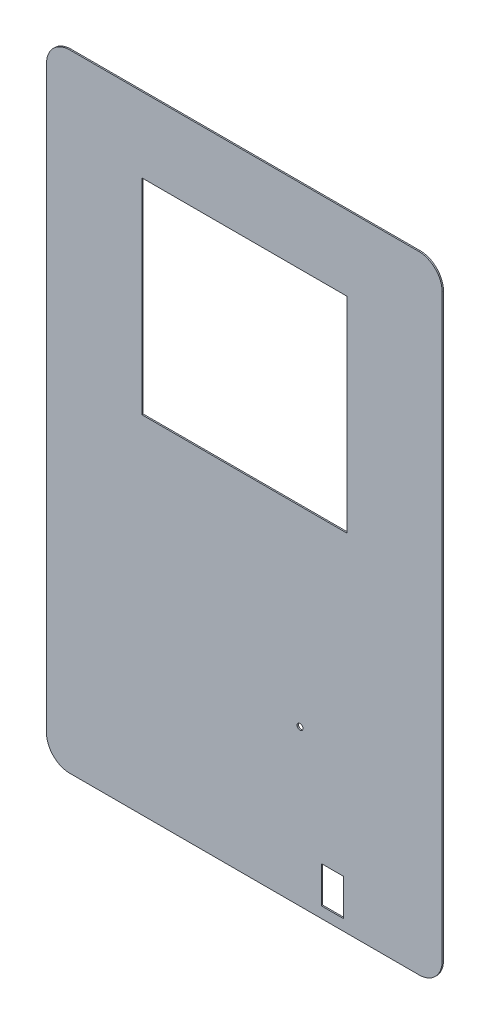
from build123d import *

# Parameters (mm, degrees)
EXTRUDE_1_DEPTH     = 0.18
CUT_EXTRUDE_1_REACH = 52.563
SKETCH_2_R          = 0.4
SKETCH_2_W          = 3
SKETCH_2_H          = 5
SKETCH_3_W          = 28
SKETCH_3_H          = 28
CUT_EXTRUDE_2_DEPTH = 0.18


with BuildPart() as part:
    # 草图1 → 凸台-拉伸1 (new body)
    with BuildSketch(Plane.XY):
        with BuildLine():
            Line((-23.82, -42.75), (23.82, -42.75))
            ThreePointArc((23.82, -42.75), (26.068599564, -41.818599564), (27, -39.57))
            Line((27, -39.57), (27, 39.57))
            ThreePointArc((27, 39.57), (26.068599564, 41.818599564), (23.82, 42.75))
            Line((23.82, 42.75), (-23.82, 42.75))
            ThreePointArc((-23.82, 42.75), (-26.068599564, 41.818599564), (-27, 39.57))
            Line((-27, 39.57), (-27, -39.57))
            ThreePointArc((-27, -39.57), (-26.068599564, -41.818599564), (-23.82, -42.75))
        make_face()
    extrude(amount=EXTRUDE_1_DEPTH)

    # 草图2 → 切除-拉伸1 (cut, up to next)
    with BuildSketch(Plane.XY.offset(0.18), mode=Mode.PRIVATE) as cut_extrude_1_sk1:
        with Locations((7.6, -21.55)):
            Circle(SKETCH_2_R)
    cut_extrude_1_tool1 = extrude(cut_extrude_1_sk1.sketch, amount=-CUT_EXTRUDE_1_REACH, mode=Mode.PRIVATE) & part.part
    # 草图2 → 切除-拉伸1 (cut, up to next)
    with BuildSketch(Plane.XY.offset(0.18), mode=Mode.PRIVATE) as cut_extrude_1_sk2:
        with Locations((12, -38.75)):
            Rectangle(SKETCH_2_W, SKETCH_2_H)
    cut_extrude_1_tool2 = extrude(cut_extrude_1_sk2.sketch, amount=-CUT_EXTRUDE_1_REACH, mode=Mode.PRIVATE) & part.part
    add(cut_extrude_1_tool1.solids().sort_by_distance((7.6, -21.55, 0.18))[0], mode=Mode.SUBTRACT)
    add(cut_extrude_1_tool2.solids().sort_by_distance((12, -38.75, 0.18))[0], mode=Mode.SUBTRACT)

    # 草图3 → 切除-拉伸2 (cut)
    with BuildSketch(Plane.XY.offset(0.18)):
        with Locations((0, 18.55)):
            Rectangle(SKETCH_3_W, SKETCH_3_H)
    extrude(amount=-CUT_EXTRUDE_2_DEPTH, mode=Mode.SUBTRACT)


solid = part.part
